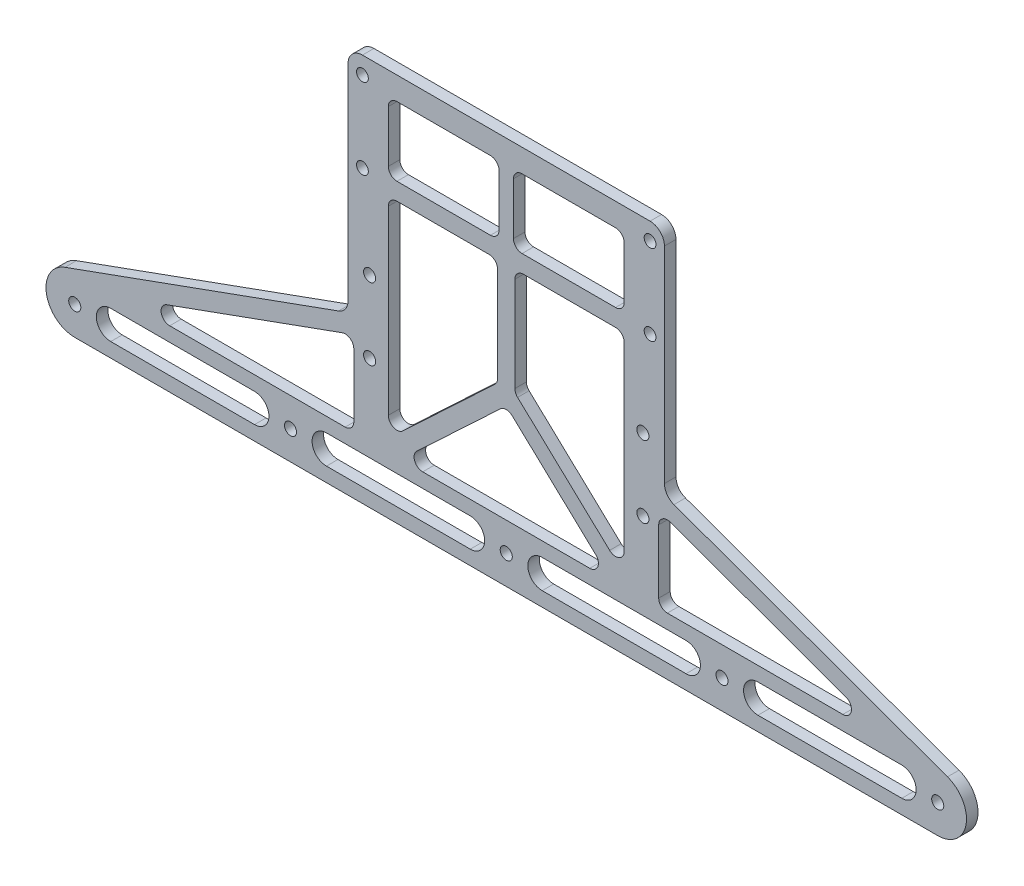
from build123d import *

# Parameters (mm, degrees)
SKETCH_1_W          = 110
SKETCH_1_H          = 40
SKETCH_1_R          = 2.05
EXTRUDE_1_DEPTH     = 4
SKETCH_2_R          = 2.1
SKETCH_2_W          = 110
SKETCH_2_H          = 40
EXTRUDE_2_DEPTH     = 4
FILLET_3_R          = 10
FILLET_4_R          = 5
SKETCH_5_W          = 38.5
SKETCH_5_H          = 24
CUT_EXTRUDE_3_DEPTH = 10
CUT_EXTRUDE_4_DEPTH = 10
CUT_EXTRUDE_5_DEPTH = 10
FILLET_5_R          = 3
SKETCH_8_R          = 2.1
CUT_EXTRUDE_6_DEPTH = 10


with BuildPart() as part:
    # 草图1 → 凸台-拉伸1 (new body)
    with BuildSketch(Plane.XY):
        Rectangle(SKETCH_1_W, SKETCH_1_H)
        with Locations((-50, 14)):
            Circle(SKETCH_1_R, mode=Mode.SUBTRACT)
        with Locations((50, 14)):
            Circle(SKETCH_1_R, mode=Mode.SUBTRACT)
        with Locations((50, -14)):
            Circle(SKETCH_1_R, mode=Mode.SUBTRACT)
        with Locations((-50, -14)):
            Circle(SKETCH_1_R, mode=Mode.SUBTRACT)
    extrude(amount=EXTRUDE_1_DEPTH)

    # 草图2 → 凸台-拉伸2 (add)
    # profile 1 of 2: a face of its own
    with BuildSketch(Plane.XY.offset(4)):
        Polygon((-207.040642195, -115), (207.040642195, -115), (55, -60), (-55, -60), align=None)
        with Locations((150, -105)):
            Circle(SKETCH_2_R, mode=Mode.SUBTRACT)
        with Locations((75, -105)):
            Circle(SKETCH_2_R, mode=Mode.SUBTRACT)
        with Locations((0, -105)):
            Circle(SKETCH_2_R, mode=Mode.SUBTRACT)
        with Locations((-75, -105)):
            Circle(SKETCH_2_R, mode=Mode.SUBTRACT)
        with Locations((-150, -105)):
            Circle(SKETCH_2_R, mode=Mode.SUBTRACT)
    # profile 2 of 2: a face of its own
    with BuildSketch(Plane.XY.offset(4)):
        with Locations((0, -40)):
            Rectangle(SKETCH_2_W, SKETCH_2_H)
    extrude(amount=-EXTRUDE_2_DEPTH)

    # 圆角3
    fillet_3_edges = [part.edges().sort_by_distance(p)[0] for p in [
        (-207.040642195, -115, 2),
        (207.040642195, -115, 2),
    ]]
    fillet(fillet_3_edges, radius=FILLET_3_R)

    # 圆角4
    fillet_4_edges = [part.edges().sort_by_distance(p)[0] for p in [
        (55, -60, 2),
        (-55, -60, 2),
        (-55, 20, 2),
        (55, 20, 2),
    ]]
    fillet(fillet_4_edges, radius=FILLET_4_R)

    # 草图5 → 切除-拉伸3 (cut)
    with BuildSketch(Plane.XY.offset(4)):
        with Locations((-21.75, 0)):
            Rectangle(SKETCH_5_W, SKETCH_5_H)
        with Locations((21.75, 0)):
            Rectangle(SKETCH_5_W, SKETCH_5_H)
        Polygon((-3, -18), (-36.617445924, -18), (-3, -49.56760166), align=None)
        Polygon((-36.617445924, -18), (-41, -18), (-41, -22.115325169), (-4.382554076, -56.5), (-3, -55.201748001), (-3, -49.56760166), align=None)
        Polygon((-4.382554076, -56.5), (-41, -22.115325169), (-41, -90.884674831), align=None)
        Polygon((36.617445924, -18), (3, -18), (3, -49.56760166), align=None)
        Polygon((41, -18), (36.617445924, -18), (3, -49.56760166), (3, -55.201748001), (4.382554076, -56.5), (41, -22.115325169), align=None)
        Polygon((41, -22.115325169), (4.382554076, -56.5), (41, -90.884674831), align=None)
        Polygon((36.617445924, -95), (3, -63.43239834), (3, -95), align=None)
        Polygon((-3, -63.43239834), (-36.617445924, -95), (-3, -95), align=None)
    extrude(amount=-CUT_EXTRUDE_3_DEPTH, mode=Mode.SUBTRACT)

    # 草图6 → 切除-拉伸4 (cut)
    with BuildSketch(Plane.XY.offset(4)):
        with BuildLine():
            Line((-137.5, -100), (-87.5, -100))
            ThreePointArc((-87.5, -100), (-82.5, -105), (-87.5, -110))
            Line((-87.5, -110), (-137.5, -110))
            ThreePointArc((-137.5, -110), (-142.5, -105), (-137.5, -100))
        make_face()
        with BuildLine():
            Line((-62.5, -100), (-12.5, -100))
            ThreePointArc((-12.5, -100), (-7.5, -105), (-12.5, -110))
            Line((-12.5, -110), (-62.5, -110))
            ThreePointArc((-62.5, -110), (-67.5, -105), (-62.5, -100))
        make_face()
        with BuildLine():
            Line((12.5, -100), (62.5, -100))
            ThreePointArc((62.5, -100), (67.5, -105), (62.5, -110))
            Line((62.5, -110), (12.5, -110))
            ThreePointArc((12.5, -110), (7.5, -105), (12.5, -100))
        make_face()
        with BuildLine():
            Line((87.5, -100), (137.5, -100))
            ThreePointArc((137.5, -100), (142.5, -105), (137.5, -110))
            Line((137.5, -110), (87.5, -110))
            ThreePointArc((87.5, -110), (82.5, -105), (87.5, -100))
        make_face()
        Polygon((-53, -65.657022536), (-134.115002501, -95), (-53, -95), align=None)
        Polygon((134.115002501, -95), (53, -95), (53, -65.657022536), align=None)
    extrude(amount=-CUT_EXTRUDE_4_DEPTH, mode=Mode.SUBTRACT)

    # 草图7 → 切除-拉伸5 (cut)
    with BuildSketch(Plane.XY.offset(4)):
        Polygon((-3, -95), (3, -95), (3, -63.43239834), (0, -60.615325169), (-3, -63.43239834), align=None)
    extrude(amount=-CUT_EXTRUDE_5_DEPTH, mode=Mode.SUBTRACT)

    # 圆角5
    fillet_5_edges = [part.edges().sort_by_distance(p)[0] for p in [
        (3, -18, 2),
        (41, -18, 2),
        (41, -90.884674831, 2),
        (3, -55.201748001, 2),
        (36.617445924, -95, 2),
        (-3, -18, 2),
        (-3, -55.201748001, 2),
        (-41, -90.884674831, 2),
        (-41, -18, 2),
        (2.5, 12, 2),
        (41, 12, 2),
        (41, -12, 2),
        (2.5, -12, 2),
        (-36.617445924, -95, 2),
        (-2.5, 12, 2),
        (-2.5, -12, 2),
        (-41, -12, 2),
        (-41, 12, 2),
        (-53, -65.657022536, 2),
        (-53, -95, 2),
        (-134.115002501, -95, 2),
        (53, -65.657022536, 2),
        (134.115002501, -95, 2),
        (53, -95, 2),
        (0, -60.615325169, 2),
    ]]
    fillet(fillet_5_edges, radius=FILLET_5_R)

    # 草图8 → 切除-拉伸6 (cut)
    with BuildSketch(Plane.XY.offset(4)):
        with Locations((-47.5, -45)):
            Circle(SKETCH_8_R)
        with Locations((-47.5, -70)):
            Circle(SKETCH_8_R)
        with Locations((47.5, -45)):
            Circle(SKETCH_8_R)
        with Locations((47.5, -70)):
            Circle(SKETCH_8_R)
    extrude(amount=-CUT_EXTRUDE_6_DEPTH, mode=Mode.SUBTRACT)


solid = part.part
